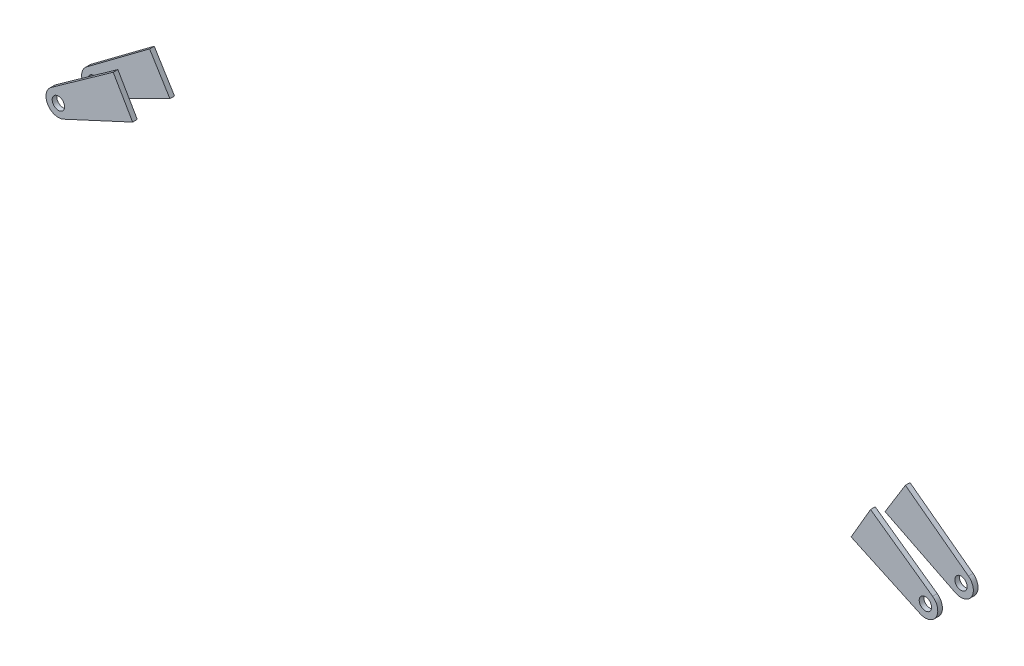
from build123d import *

# Parameters (mm, degrees)
F_3DSKETCH1_R        = 4
BOSS_EXTRUDE_U_DEPTH = 3
BOSS_EXTRUDE_L_START = -3
F_3DSKETCH2_R        = 4
BOSS_EXTRUDE_L_DEPTH = 3


with BuildPart() as part:
    # 3DSketch1 → Boss-Extrude-U (new body)
    with BuildSketch(Plane(origin=(276.636768115, -1987.258696252, 307), x_dir=(-0.6039973468272041, 0.7969863267495234, -3.557491611711546e-14), z_dir=(0, 0, 1))):
        with BuildLine():
            Line((0, 0), (43.409687354, 23.064994864))
            Line((43.409687354, 23.064994864), (53.053649815, 0))
            Line((53.053649815, 0), (6.145824381, -14.698668557))
            ThreePointArc((6.145824381, -14.698668557), (-3.627099829, -10.150751092), (0, 0))
        make_face()
        with Locations(Location((3.753698528, -7.064683104, 0), (0, 0, 232.843273819))):
            Circle(F_3DSKETCH1_R, mode=Mode.SUBTRACT)
    extrude(amount=BOSS_EXTRUDE_U_DEPTH)


with BuildPart() as body_2:
    # 3DSketch2 → Boss-Extrude-L (new body)
    with BuildSketch(Plane(origin=(276.426705148, -1987.157622783, 287), x_dir=(-0.5924370894064002, 0.8056167172394533, -4.372891384724364e-14), z_dir=(0, 0, 1)).offset(BOSS_EXTRUDE_L_START)):
        with BuildLine():
            Line((0, 0), (45.211564112, 23.1759131))
            Line((45.211564112, 23.1759131), (54.58584019, 0))
            Line((54.58584019, 0), (5.975620612, -14.773456946))
            ThreePointArc((5.975620612, -14.773456946), (-3.766944025, -10.118915622), (0, 0))
        make_face()
        with Locations(Location((3.649348167, -7.119147277, 0), (0, 0, 233.669857139))):
            Circle(F_3DSKETCH2_R, mode=Mode.SUBTRACT)
    extrude(amount=BOSS_EXTRUDE_L_DEPTH)


with BuildPart() as body_3:
    # Mirror1: mirrored copy
    add(part.part.mirror(Plane(origin=(0, 0, 0), x_dir=(0, 0, 1), z_dir=(1, 0, 0))))


with BuildPart() as body_4:
    # Mirror1 2: mirrored copy
    add(body_2.part.mirror(Plane(origin=(0, 0, 0), x_dir=(0, 0, 1), z_dir=(1, 0, 0))))


solid = Compound([part.part, body_2.part, body_3.part, body_4.part])
